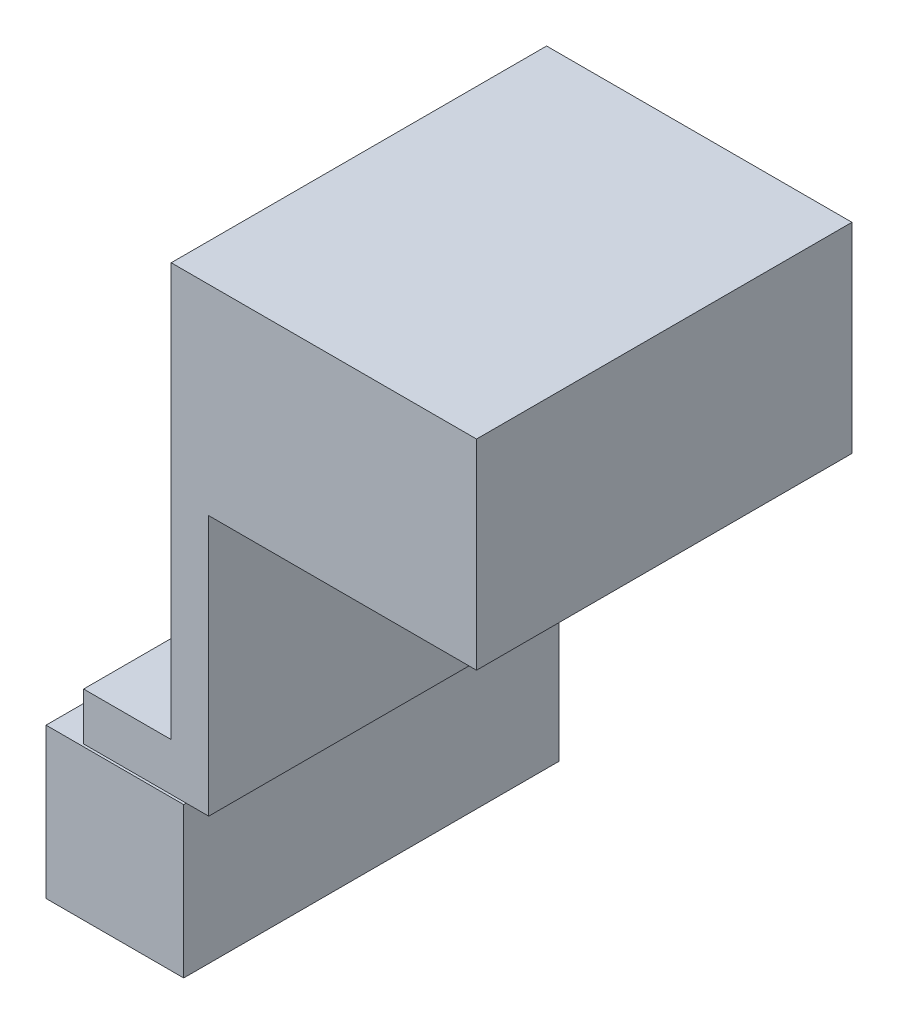
from build123d import *

# Parameters (mm, degrees)
SKETCH1_W           = 50
SKETCH1_H           = 19
SKETCH1_W_2         = 107
SKETCH1_H_2         = 80
SKETCH1_W_3         = 55
SKETCH1_H_3         = 60
BOSS_EXTRUDE1_DEPTH = 150


with BuildPart() as part:
    # Sketch1 → Boss-Extrude1 (new body)
    with BuildSketch(Plane.XY):
        with Locations((25, 9.5)):
            Rectangle(SKETCH1_W, SKETCH1_H)
        Polygon((50, 104), (50, 184), (35, 184), (35, 19), (50, 19), align=None)
        with Locations((103.5, 144)):
            Rectangle(SKETCH1_W_2, SKETCH1_H_2)
        with Locations((12.5, -31)):
            Rectangle(SKETCH1_W_3, SKETCH1_H_3)
    extrude(amount=BOSS_EXTRUDE1_DEPTH)


solid = part.part
